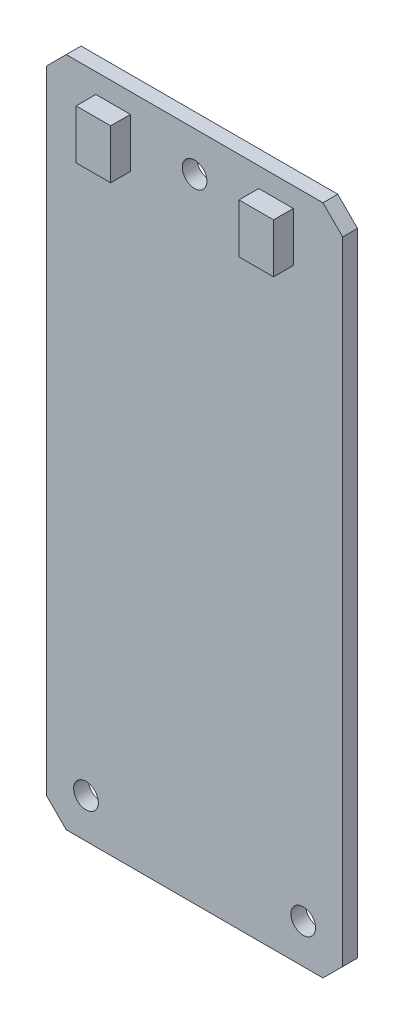
from build123d import *

# Parameters (mm, degrees)
SKETCH_1_W      = 30
SKETCH_1_H      = 68
SKETCH_1_R      = 1.25
EXTRUDE_6_DEPTH = 1.5
CHAMFER_2_SIZE  = 2
SKETCH_9_W      = 3.5
SKETCH_9_H      = 5
EXTRUDE_7_DEPTH = 2


with BuildPart() as part:
    # Эскиз1 → Бобышка-Вытянуть6 (new body)
    with BuildSketch(Plane.XY):
        with Locations((15, 34)):
            Rectangle(SKETCH_1_W, SKETCH_1_H)
        with Locations((15, 64)):
            Circle(SKETCH_1_R, mode=Mode.SUBTRACT)
        with Locations((4, 4)):
            Circle(SKETCH_1_R, mode=Mode.SUBTRACT)
        with Locations((26, 4)):
            Circle(SKETCH_1_R, mode=Mode.SUBTRACT)
    extrude(amount=EXTRUDE_6_DEPTH)

    # Фаска2
    chamfer_2_edges = [part.edges().sort_by_distance(p)[0] for p in [
        (0, 68, 0.75),
        (30, 68, 0.75),
        (30, 0, 0.75),
        (0, 0, 0.75),
    ]]
    chamfer(chamfer_2_edges, length=CHAMFER_2_SIZE)

    # Эскиз9 → Бобышка-Вытянуть7 (add)
    with BuildSketch(Plane.XY.offset(1.5)):
        with Locations((6.75, 63.5)):
            Rectangle(SKETCH_9_W, SKETCH_9_H)
        with Locations((23.25, 63.5)):
            Rectangle(SKETCH_9_W, SKETCH_9_H)
    extrude(amount=EXTRUDE_7_DEPTH)


solid = part.part
